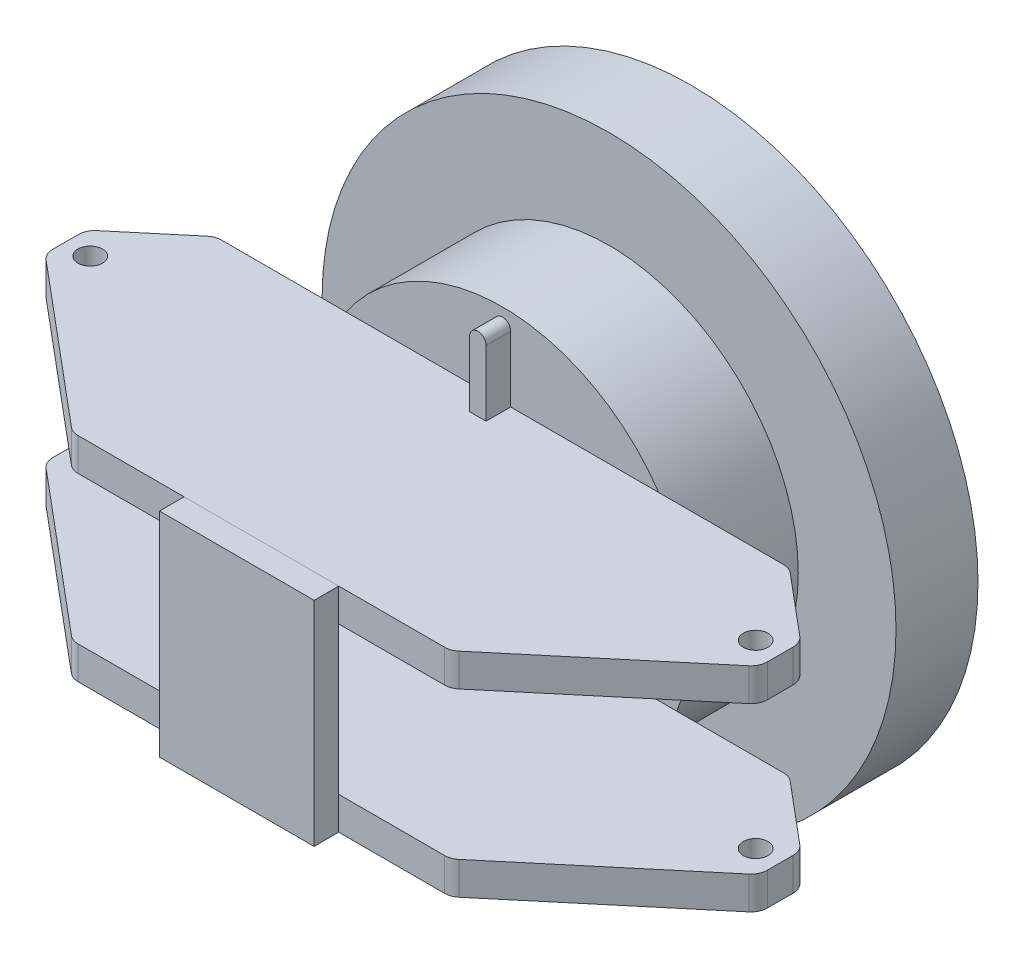
from build123d import *

# Parameters (mm, degrees)
SKETCH1_R                   = 35
BOSS_EXTRUDE1_DEPTH         = 10
SKETCH2_R                   = 23.08
BOSS_EXTRUDE2_DEPTH         = 13
BOSS_EXTRUDE3_DEPTH         = 4
FILLET1_R                   = 2
SKETCH5_R                   = 1.5
CUT_EXTRUDE1_DEPTH          = 4
MIRROR2_COPY_1_SKETCH_R     = 1.5
MIRROR2_COPY_1_DEPTH        = 4
FILLET1_OF_MIRROR2_R        = 2
SKETCH6_W                   = 2
SKETCH6_H                   = 9
BOSS_EXTRUDE4_DEPTH         = 3
FILLET2_RADIUS              = 1
FILLET2_LENGTH              = 3
FILLET2_OF_MIRROR3_2_RADIUS = 1
FILLET2_OF_MIRROR3_2_LENGTH = 3
SKETCH7_W                   = 18.86
SKETCH7_H                   = 26
BOSS_EXTRUDE5_DEPTH         = 3
SKETCH8_R                   = 10
CUT_EXTRUDE2_DEPTH          = 10


with BuildPart() as part:
    # Sketch1 → Boss-Extrude1 (new body)
    with BuildSketch(Plane.XY):
        Circle(SKETCH1_R)
    extrude(amount=BOSS_EXTRUDE1_DEPTH)

    # Sketch2 → Boss-Extrude2 (add)
    with BuildSketch(Plane.XY.offset(10)):
        with Locations(Location((0, 0, 0), (0, 0, 180))):
            Circle(SKETCH2_R)
    extrude(amount=BOSS_EXTRUDE2_DEPTH)

    # Sketch4 → Boss-Extrude3 (add)
    with BuildSketch(Plane(origin=(0, 13, 0), x_dir=(1, 0, 0), z_dir=(0, 1, 0))):
        Polygon((35, -23), (-35, -23), (-43.579697763, -30.199221228), (-43.579697763, -35.199221228), (-23.08, -52.400510061), (23.08, -52.400510061), (43.579697763, -35.199221228), (43.579697763, -30.199221228), align=None)
    boss_extrude3 = extrude(amount=-BOSS_EXTRUDE3_DEPTH)

    # Fillet1
    fillet1_edges = [part.edges().sort_by_distance(p)[0] for p in [
        (-43.579697763, 11, 30.199221228),
        (-35, 11, 23),
        (35, 11, 23),
        (43.579697763, 11, 30.199221228),
        (43.579697763, 11, 35.199221228),
        (23.08, 11, 52.400510061),
        (-23.08, 11, 52.400510061),
        (-43.579697763, 11, 35.199221228),
    ]]
    fillet(fillet1_edges, radius=FILLET1_R)

    # Sketch5 → Cut-Extrude1 (cut)
    with BuildSketch(Plane(origin=(0, 13, 0), x_dir=(1, 0, 0), z_dir=(0, 1, 0))):
        with Locations(Location((-40.579697763, -32.699221228, 0), (0, 0, 270))):
            Circle(SKETCH5_R)
    cut_extrude1 = extrude(amount=-CUT_EXTRUDE1_DEPTH, mode=Mode.SUBTRACT)

    # Mirror1: Cut-Extrude1 across plane
    add(cut_extrude1.mirror(Plane(origin=(0, 0, 0), x_dir=(0, 0, 1), z_dir=(1, 0, 0))), mode=Mode.SUBTRACT)

    # Mirror2: Boss-Extrude3, Cut-Extrude1 across plane
    add(boss_extrude3.mirror(Plane.ZX))
    add(cut_extrude1.mirror(Plane.ZX), mode=Mode.SUBTRACT)

    # Mirror2 copy 1 sketch → Mirror2 copy 1 (cut)
    with BuildSketch(Plane(origin=(0, -13, 0), x_dir=(-1, 0, 0), z_dir=(0, -1, 0))):
        with Locations(Location((-40.579697763, -32.699221228, 0), (0, 0, 270))):
            Circle(MIRROR2_COPY_1_SKETCH_R)
    extrude(amount=-MIRROR2_COPY_1_DEPTH, mode=Mode.SUBTRACT)

    # Fillet1 of Mirror2
    fillet1_of_mirror2_edges = [part.edges().sort_by_distance(p)[0] for p in [
        (-43.579697763, -11, 30.199221228),
        (-35, -11, 23),
        (35, -11, 23),
        (43.579697763, -11, 30.199221228),
        (43.579697763, -11, 35.199221228),
        (23.08, -11, 52.400510061),
        (-23.08, -11, 52.400510061),
        (-43.579697763, -11, 35.199221228),
    ]]
    fillet(fillet1_of_mirror2_edges, radius=FILLET1_OF_MIRROR2_R)

    # Sketch6 → Boss-Extrude4 (add)
    with BuildSketch(Plane.XY.offset(23)):
        with Locations((0, 17.5)):
            Rectangle(SKETCH6_W, SKETCH6_H)
    boss_extrude4 = extrude(amount=BOSS_EXTRUDE4_DEPTH)

    # Fillet2: full round fillet: the end face becomes a half cylinder, R = half its width
    fillet2_face = Plane((0, 22, 24.5), x_dir=(0, 0, -1), z_dir=(0, 1, 0))  # on the end face: x along it, z out of the body
    fillet2_slab = fillet2_face.offset(-FILLET2_RADIUS / 2) * Box(FILLET2_LENGTH, 2 * FILLET2_RADIUS, FILLET2_RADIUS, mode=Mode.PRIVATE)  # the body's end, R deep
    fillet2_round = Plane((0, 21, 24.5), x_dir=(0, 1, 0), z_dir=(0, 0, -1)) * Cylinder(FILLET2_RADIUS, FILLET2_LENGTH, mode=Mode.PRIVATE)  # its axis R under the face
    add(fillet2_slab - fillet2_round, mode=Mode.SUBTRACT)

    # Mirror3: Boss-Extrude4 across plane
    add(boss_extrude4.mirror(Plane.ZX))

    # Fillet2 of Mirror3 2: full round fillet: the end face becomes a half cylinder, R = half its width
    fillet2_of_mirror3_2_face = Plane((0, -22, 24.5), x_dir=(0, 0, -1), z_dir=(0, -1, 0))  # on the end face: x along it, z out of the body
    fillet2_of_mirror3_2_slab = fillet2_of_mirror3_2_face.offset(-FILLET2_OF_MIRROR3_2_RADIUS / 2) * Box(FILLET2_OF_MIRROR3_2_LENGTH, 2 * FILLET2_OF_MIRROR3_2_RADIUS, FILLET2_OF_MIRROR3_2_RADIUS, mode=Mode.PRIVATE)  # the body's end, R deep
    fillet2_of_mirror3_2_round = Plane((0, -21, 24.5), x_dir=(0, -1, 0), z_dir=(0, 0, -1)) * Cylinder(FILLET2_OF_MIRROR3_2_RADIUS, FILLET2_OF_MIRROR3_2_LENGTH, mode=Mode.PRIVATE)  # its axis R under the face
    add(fillet2_of_mirror3_2_slab - fillet2_of_mirror3_2_round, mode=Mode.SUBTRACT)

    # Sketch8 → Cut-Extrude2 (cut)
    with BuildSketch(Plane(origin=(0, 0, 0), x_dir=(-1, 0, 0), z_dir=(0, 0, -1))):
        Circle(SKETCH8_R)
    extrude(amount=-CUT_EXTRUDE2_DEPTH, mode=Mode.SUBTRACT)


with BuildPart() as body_2:
    # Sketch7 → Boss-Extrude5 (new body)
    with BuildSketch(Plane.XY.offset(52.400510061)):
        Rectangle(SKETCH7_W, SKETCH7_H)
    extrude(amount=BOSS_EXTRUDE5_DEPTH)


solid = Compound([part.part, body_2.part])
